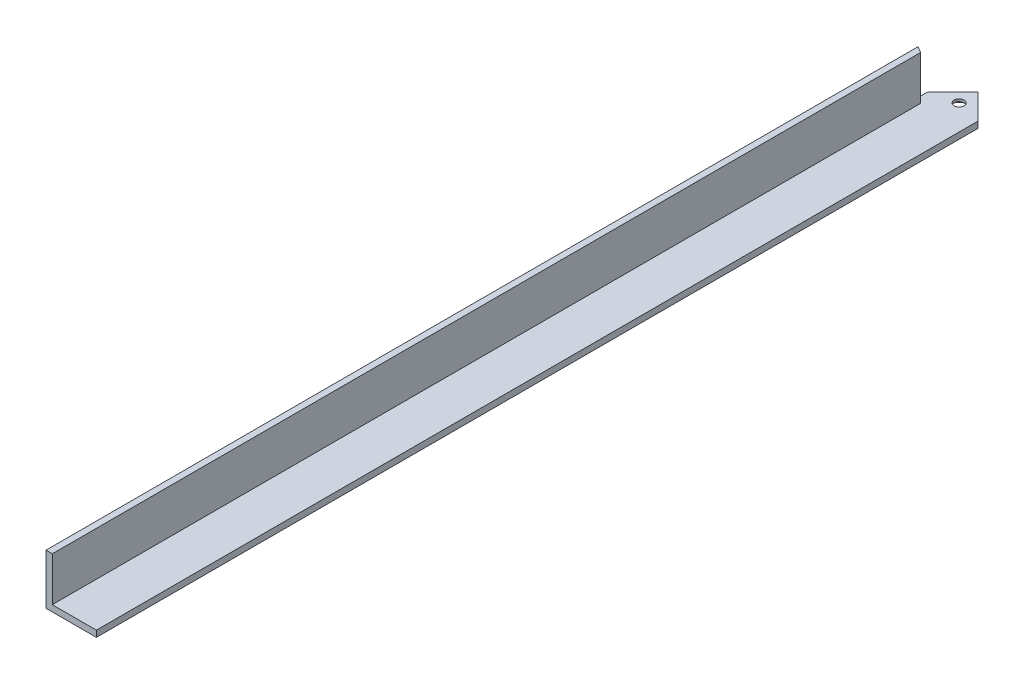
from build123d import *

# Parameters (mm, degrees)
BOSS_EXTRUDE1_DEPTH                                 = 914.4
CUT_EXTRUDE1_REACH                                  = 918.888
SKETCH2_R                                           = 43.18
CUT_EXTRUDE2_DEPTH                                  = 1219.2
CSK_FOR_3_8_FLAT_HEAD_MACHINE_SCREW_100_D           = 10.0838
CSK_FOR_3_8_FLAT_HEAD_MACHINE_SCREW_100_CSINK_D     = 19.3548
CSK_FOR_3_8_FLAT_HEAD_MACHINE_SCREW_100_CSINK_ANGLE = 100


with BuildPart() as part:
    # Sketch1 → Boss-Extrude1 (new body)
    with BuildSketch(Plane.XY):
        Polygon((0, 50.8), (0, 0), (50.8, 0), (50.8, 6.35), (6.35, 6.35), (6.35, 50.8), align=None)
    extrude(amount=BOSS_EXTRUDE1_DEPTH)

    # Sketch2 → Cut-Extrude1 (cut, up to next)
    with BuildSketch(Plane(origin=(0, 6.35, 0), x_dir=(1, 0, 0), z_dir=(0, 1, 0)), mode=Mode.PRIVATE) as cut_extrude1_sk1:
        with Locations((25.4, 0)):
            Circle(SKETCH2_R)
    cut_extrude1_tool1 = extrude(cut_extrude1_sk1.sketch, amount=CUT_EXTRUDE1_REACH, mode=Mode.PRIVATE) & part.part
    add(cut_extrude1_tool1.solids().sort_by_distance((25.4, 6.35, 0))[0], mode=Mode.SUBTRACT)

    # Sketch3 → Cut-Extrude2 (cut)
    with BuildSketch(Plane(origin=(0, 6.35, 0), x_dir=(1, 0, 0), z_dir=(0, 1, 0))):
        with BuildLine():
            Line((25.4, 0), (-1.540768363, -26.940768363))
            ThreePointArc((-1.540768363, -26.940768363), (25.4, 38.1), (52.340768363, -26.940768363))
            Line((52.340768363, -26.940768363), (25.4, 0))
        make_face()
    extrude(amount=-CUT_EXTRUDE2_DEPTH, mode=Mode.SUBTRACT)

    # CSK for 3/8 Flat Head Machine Screw (100)1 (through all)
    with Locations(Plane(origin=(0, 0, 0), x_dir=(-1, 0, 0), z_dir=(0, -1, 0))):
        with Locations((-25.4, -19.05)):
            CounterSinkHole(CSK_FOR_3_8_FLAT_HEAD_MACHINE_SCREW_100_D / 2, CSK_FOR_3_8_FLAT_HEAD_MACHINE_SCREW_100_CSINK_D / 2, counter_sink_angle=CSK_FOR_3_8_FLAT_HEAD_MACHINE_SCREW_100_CSINK_ANGLE)


solid = part.part
